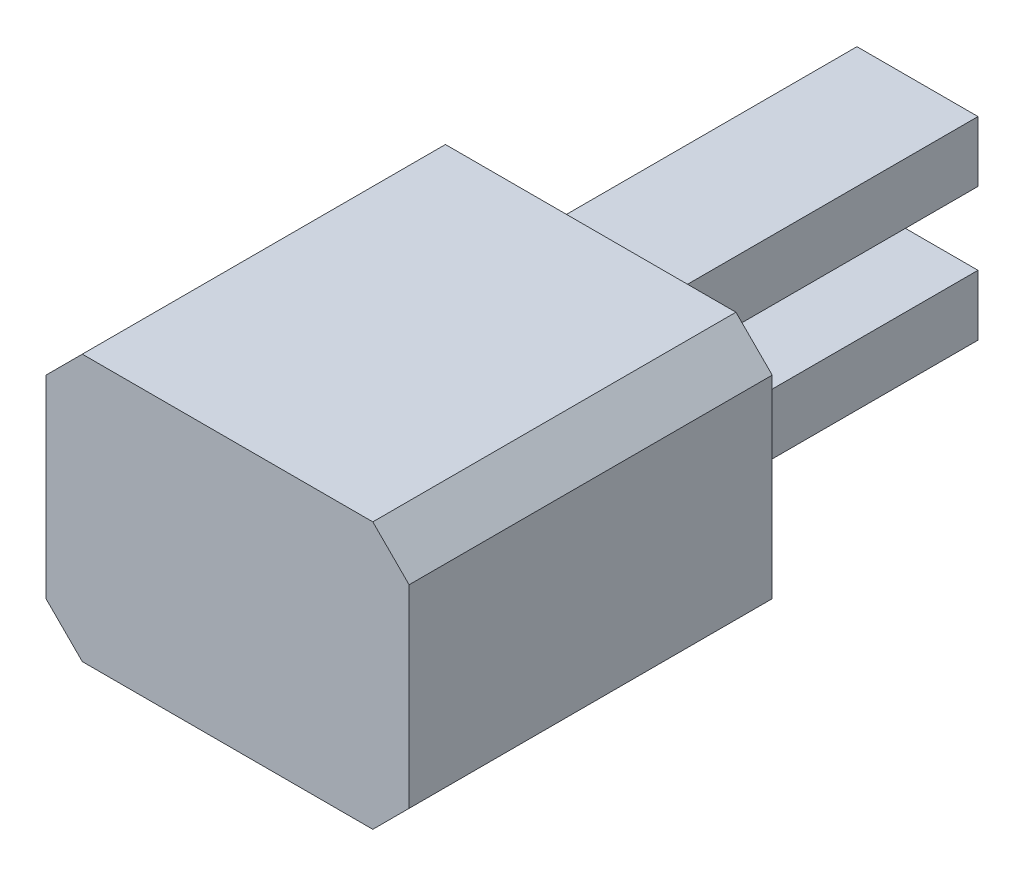
from build123d import *

# Parameters (mm, degrees)
BODY_DEPTH     = 60
SK_FINGER_A_W  = 20
SK_FINGER_A_H  = 10
FINGER_A_DEPTH = 54
SK_FINGER_B_W  = 20
SK_FINGER_B_H  = 10
FINGER_B_DEPTH = 54


with BuildPart() as part:
    # SK_Body → Body (new body)
    with BuildSketch(Plane.XY.offset(-66)):
        Polygon((-24, -22), (24, -22), (30, -16), (30, 16), (24, 22), (-24, 22), (-30, 16), (-30, -16), align=None)
    extrude(amount=BODY_DEPTH)

    # SK_Finger_A → Finger_A (add)
    with BuildSketch(Plane.XY.offset(-120)):
        with Locations((0, 11)):
            Rectangle(SK_FINGER_A_W, SK_FINGER_A_H)
    extrude(amount=FINGER_A_DEPTH)

    # SK_Finger_B → Finger_B (add)
    with BuildSketch(Plane.XY.offset(-120)):
        with Locations((0, -11)):
            Rectangle(SK_FINGER_B_W, SK_FINGER_B_H)
    extrude(amount=FINGER_B_DEPTH)


solid = part.part
